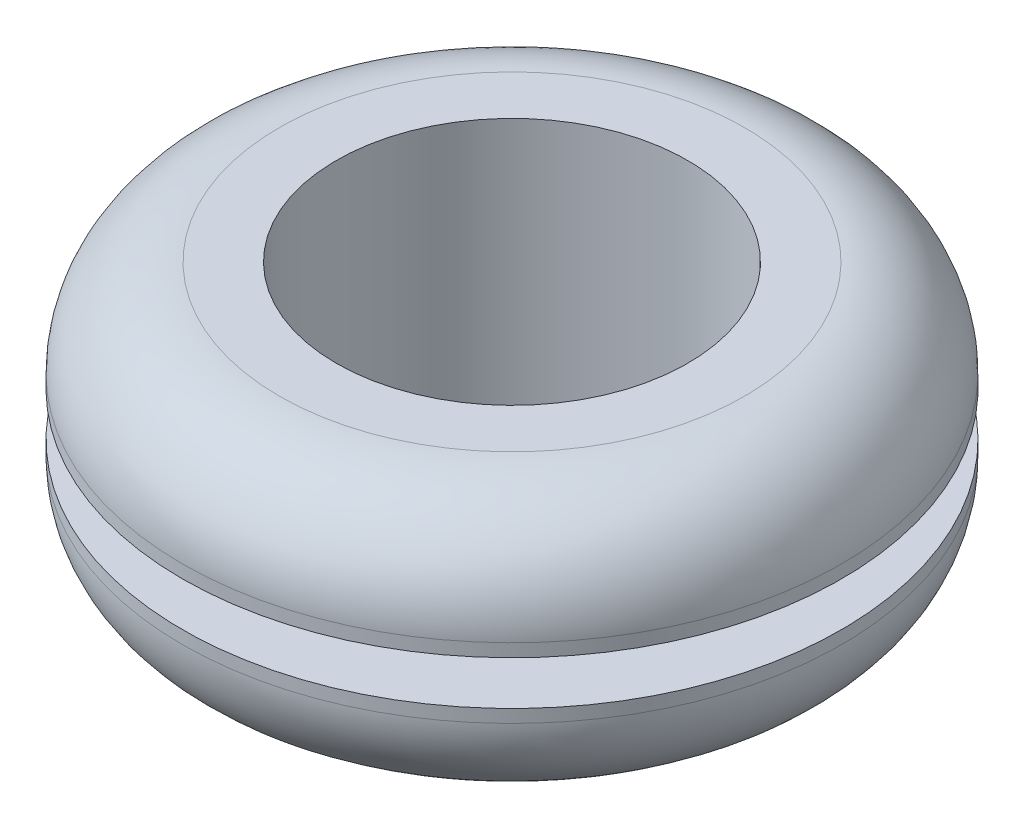
from build123d import *

# Parameters (mm, degrees)
SKETCH1_R           = 8.73125
BOSS_EXTRUDE1_DEPTH = 9.525
SKETCH3_R           = 11.90625
BOSS_EXTRUDE2_DEPTH = 3.96875
BOSS_EXTRUDE3_START = -3.96875
SKETCH4_R           = 11.90625
BOSS_EXTRUDE3_DEPTH = 3.96875
SKETCH2_R           = 6.35
CUT_EXTRUDE2_DEPTH  = 20.345366451
FILLET2_R           = 3.5


with BuildPart() as part:
    # Sketch1 → Boss-Extrude1 (new body)
    with BuildSketch(Plane(origin=(0, 0, 0), x_dir=(1, 0, 0), z_dir=(0, 1, 0))):
        with Locations(Location((0, 0, 0), (0, 0, 90))):
            Circle(SKETCH1_R)
    extrude(amount=BOSS_EXTRUDE1_DEPTH)

    # Sketch3 → Boss-Extrude2 (add)
    with BuildSketch(Plane(origin=(0, 9.525, 0), x_dir=(1, 0, 0), z_dir=(0, 1, 0))):
        with Locations(Location((0, 0, 0), (0, 0, 270))):
            Circle(SKETCH3_R)
    extrude(amount=-BOSS_EXTRUDE2_DEPTH)

    # Sketch4 → Boss-Extrude3 (add)
    with BuildSketch(Plane(origin=(0, 0, 0), x_dir=(-1, 0, 0), z_dir=(0, -1, 0)).offset(BOSS_EXTRUDE3_START)):
        with Locations(Location((0, 0, 0), (0, 0, 270))):
            Circle(SKETCH4_R)
    extrude(amount=BOSS_EXTRUDE3_DEPTH)

    # Sketch2 → Cut-Extrude2 (cut, through all)
    with BuildSketch(Plane(origin=(0, 9.525, 0), x_dir=(1, 0, 0), z_dir=(0, 1, 0))):
        with Locations(Location((0, 0, 0), (0, 0, 270))):
            Circle(SKETCH2_R)
    extrude(amount=-CUT_EXTRUDE2_DEPTH, mode=Mode.SUBTRACT)

    # Fillet2
    fillet2_edges = [part.edges().sort_by_distance(p)[0] for p in [
        (0, 0, -11.90625),
        (0, 9.525, -11.90625),
    ]]
    fillet(fillet2_edges, radius=FILLET2_R)


solid = part.part
